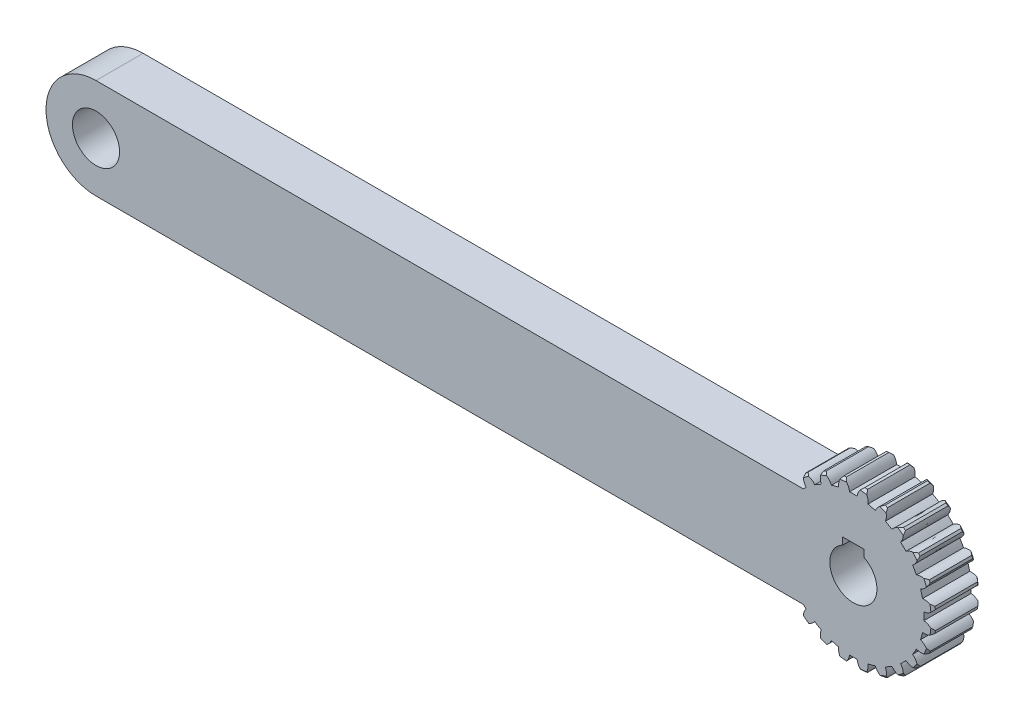
from build123d import *

# Parameters (mm, degrees)
SKETCH_2_R               = 17
EXTRUDE_2_DEPTH          = 10
CUT_EXTRUDE_1_DEPTH      = 10
PATTERN_CIRCULAR_1_COUNT = 24
SKETCH_6_OUTSIDE_W       = 47.536
SKETCH_6_OUTSIDE_H       = 47.536
SKETCH_6_OUTSIDE_R       = 16.5
CUT_EXTRUDE_9_DEPTH      = 1
CUT_EXTRUDE_9_DRAFT      = -45
SKETCH_8_OUTSIDE_W       = 47.536
SKETCH_8_OUTSIDE_H       = 47.536
SKETCH_8_OUTSIDE_R       = 16.5
CUT_EXTRUDE_10_DEPTH     = 1
CUT_EXTRUDE_10_DRAFT     = -45
EXTRUDE_3_DEPTH          = 10
CUT_EXTRUDE_11_DEPTH     = 10
SKETCH_14_R              = 5
CUT_EXTRUDE_12_DEPTH     = 10


with BuildPart() as part:
    # 草图2 → 凸台-拉伸2 (new body)
    with BuildSketch(Plane.XY):
        Circle(SKETCH_2_R)
    extrude(amount=EXTRUDE_2_DEPTH)

    # 草图5 → 切除-拉伸1 (cut)
    with BuildSketch(Plane.XY.offset(10)):
        with BuildLine():
            Line((-1.946986543, 16.888139134), (-1.946986543, 17.571712885))
            Line((-1.946986543, 17.571712885), (1.946986543, 17.571712885))
            Line((1.946986543, 17.571712885), (1.946986543, 16.888139134))
            add(Edge.make_bspline(
                [(1.946986543, 16.888139134), (0.967504316, 16.161638407), (0.799991739, 14.978651916)],
                knots=[0, 0, 0, 1, 1, 1], degree=2))
            ThreePointArc((0.799991739, 14.978651916), (0, 15), (-0.799991739, 14.978651916))
            add(Edge.make_bspline(
                [(-1.946986543, 16.888139134), (-0.967504316, 16.161638407), (-0.799991739, 14.978651916)],
                knots=[0, 0, 0, 1, 1, 1], degree=2))
        make_face()
    cut_extrude_1 = extrude(amount=-CUT_EXTRUDE_1_DEPTH, mode=Mode.SUBTRACT)

    # 阵列(圆周)1: 切除-拉伸1 ×24 about axis
    pattern_circular_1_axis = Axis((0, 0, 10), (0, 0, -1))
    for i in range(1, PATTERN_CIRCULAR_1_COUNT):
        add(cut_extrude_1.rotate(pattern_circular_1_axis, i * 360 / PATTERN_CIRCULAR_1_COUNT), mode=Mode.SUBTRACT)


with BuildPart() as cut_extrude_9_tool:
    # 草图6 outside → 切除-拉伸9 (with draft: the straight prism first)
    with BuildSketch(Plane.XY.offset(10)):
        Rectangle(SKETCH_6_OUTSIDE_W, SKETCH_6_OUTSIDE_H)
        Circle(SKETCH_6_OUTSIDE_R, mode=Mode.SUBTRACT)
    extrude(amount=-CUT_EXTRUDE_9_DEPTH)
    # 切除-拉伸9: the draft: its side faces are tilted about the plane it starts from
    cut_extrude_9_sides = [cut_extrude_9_tool.faces().sort_by_distance(p)[0] for p in [
        (0, -23.768, 9.5),
        (23.768, 0, 9.5),
        (0, 23.768, 9.5),
        (-23.768, 0, 9.5),
        (-16.5, 0, 9.5),
    ]]
    draft(cut_extrude_9_sides, Plane.XY.offset(10), CUT_EXTRUDE_9_DRAFT)


with BuildPart() as part_1:
    add(part.part)

    # 切除-拉伸9: cut by cut_extrude_9_tool
    add(cut_extrude_9_tool.part, mode=Mode.SUBTRACT)


with BuildPart() as cut_extrude_10_tool:
    # 草图8 outside → 切除-拉伸10 (with draft: the straight prism first)
    with BuildSketch(Plane(origin=(0, 0, 0), x_dir=(-1, 0, 0), z_dir=(0, 0, -1))):
        Rectangle(SKETCH_8_OUTSIDE_W, SKETCH_8_OUTSIDE_H)
        Circle(SKETCH_8_OUTSIDE_R, mode=Mode.SUBTRACT)
    extrude(amount=-CUT_EXTRUDE_10_DEPTH)
    # 切除-拉伸10: the draft: its side faces are tilted about the plane it starts from
    cut_extrude_10_sides = [cut_extrude_10_tool.faces().sort_by_distance(p)[0] for p in [
        (0, -23.768, 0.5),
        (-23.768, 0, 0.5),
        (0, 23.768, 0.5),
        (23.768, 0, 0.5),
        (16.5, 0, 0.5),
    ]]
    draft(cut_extrude_10_sides, Plane(origin=(0, 0, 0), x_dir=(-1, 0, 0), z_dir=(0, 0, -1)), CUT_EXTRUDE_10_DRAFT)


with BuildPart() as part_2:
    add(part_1.part)

    # 切除-拉伸10: cut by cut_extrude_10_tool
    add(cut_extrude_10_tool.part, mode=Mode.SUBTRACT)

    # 草图11 → 凸台-拉伸3 (add)
    with BuildSketch(Plane.XY.offset(10)):
        with BuildLine():
            Line((-10.606601718, 10.606601718), (-160.606601718, 10.606601718))
            ThreePointArc((-160.606601718, 10.606601718), (-171.213203436, 0), (-160.606601718, -10.606601718))
            Line((-160.606601718, -10.606601718), (-10.606601718, -10.606601718))
            Line((-10.606601718, -10.606601718), (-10.606601718, 10.606601718))
        make_face()
    extrude(amount=-EXTRUDE_3_DEPTH)

    # 草图13 → 切除-拉伸11 (cut)
    with BuildSketch(Plane(origin=(0, 0, 0), x_dir=(-1, 0, 0), z_dir=(0, 0, -1))):
        with BuildLine():
            Line((2.25, 4.465142775), (2.25, 5.965142775))
            Line((2.25, 5.965142775), (-2.25, 5.965142775))
            Line((-2.25, 5.965142775), (-2.25, 4.465142775))
            ThreePointArc((-2.25, 4.465142775), (0, -5), (2.25, 4.465142775))
        make_face()
    extrude(amount=-CUT_EXTRUDE_11_DEPTH, mode=Mode.SUBTRACT)

    # 草图14 → 切除-拉伸12 (cut)
    with BuildSketch(Plane(origin=(0, 0, 0), x_dir=(-1, 0, 0), z_dir=(0, 0, -1))):
        with Locations((160.606601718, 0)):
            Circle(SKETCH_14_R)
    extrude(amount=-CUT_EXTRUDE_12_DEPTH, mode=Mode.SUBTRACT)


solid = part_2.part
